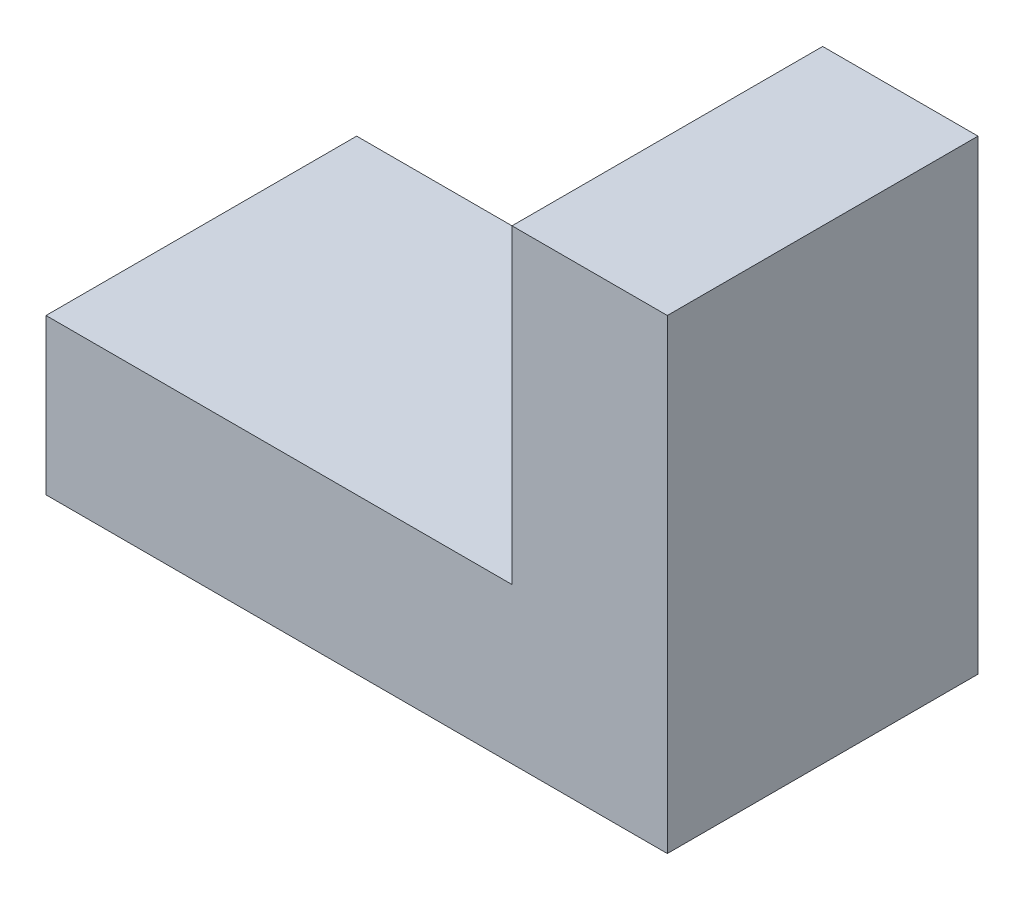
from build123d import *

# Parameters (mm, degrees)
BOSS_EXTRUDE1_DEPTH = 10


with BuildPart() as part:
    # Sketch1 → Boss-Extrude1 (new body)
    with BuildSketch(Plane(origin=(0, 0, 20), x_dir=(-1, 0, 0), z_dir=(0, 0, -1))):
        Polygon((5, 5), (25, 5), (25, 10), (10, 10), (10, 20), (5, 20), align=None)
    extrude(amount=BOSS_EXTRUDE1_DEPTH)


solid = part.part
